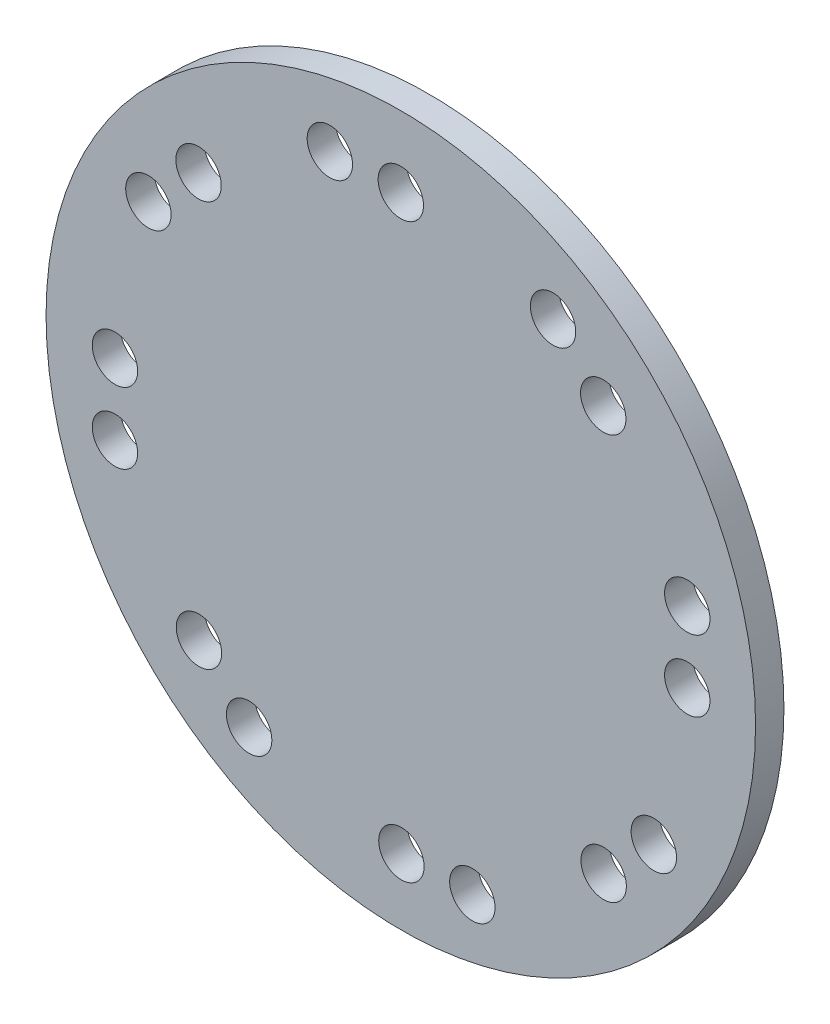
from build123d import *

# Parameters (mm, degrees)
SKETCH_1_R               = 25
EXTRUDE_1_DEPTH          = 2
SKETCH_2_R               = 1.6
CUT_EXTRUDE_1_DEPTH      = 2
PATTERN_CIRCULAR_1_COUNT = 8


with BuildPart() as part:
    # ｽｹｯﾁ1 → ﾎﾞｽ - 押し出し1 (new body)
    with BuildSketch(Plane.XY):
        Circle(SKETCH_1_R)
    extrude(amount=EXTRUDE_1_DEPTH)

    # ｽｹｯﾁ2 → ｶｯﾄ - 押し出し1 (cut)
    with BuildSketch(Plane.XY.offset(2)):
        with Locations((0, 20)):
            Circle(SKETCH_2_R)
        with Locations((-5, 20)):
            Circle(SKETCH_2_R)
    cut_extrude_1 = extrude(amount=-CUT_EXTRUDE_1_DEPTH, mode=Mode.SUBTRACT)

    # 円形ﾊﾟﾀｰﾝ1: ｶｯﾄ - 押し出し1 ×8 about axis
    pattern_circular_1_axis = Axis((0.020649158, -0.165193263, 0), (0, 0, 1))
    for i in range(1, PATTERN_CIRCULAR_1_COUNT):
        add(cut_extrude_1.rotate(pattern_circular_1_axis, i * 360 / PATTERN_CIRCULAR_1_COUNT), mode=Mode.SUBTRACT)


solid = part.part
